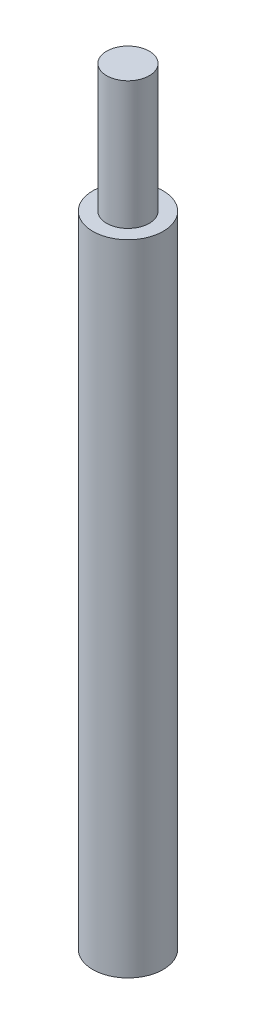
from build123d import *

# Parameters (mm, degrees)
SKETCH1_R           = 1.65
BOSS_EXTRUDE1_DEPTH = 30
SKETCH2_R           = 1
BOSS_EXTRUDE2_DEPTH = 6


with BuildPart() as part:
    # Sketch1 → Boss-Extrude1 (new body)
    with BuildSketch(Plane(origin=(0, 0, 0), x_dir=(1, 0, 0), z_dir=(0, 1, 0))):
        with Locations(Location((0, 0, 0), (0, 0, 270))):
            Circle(SKETCH1_R)
    extrude(amount=BOSS_EXTRUDE1_DEPTH)

    # Sketch2 → Boss-Extrude2 (add)
    with BuildSketch(Plane(origin=(0, 30, 0), x_dir=(1, 0, 0), z_dir=(0, 1, 0))):
        with Locations(Location((0, 0, 0), (0, 0, 270))):
            Circle(SKETCH2_R)
    extrude(amount=BOSS_EXTRUDE2_DEPTH)


solid = part.part
